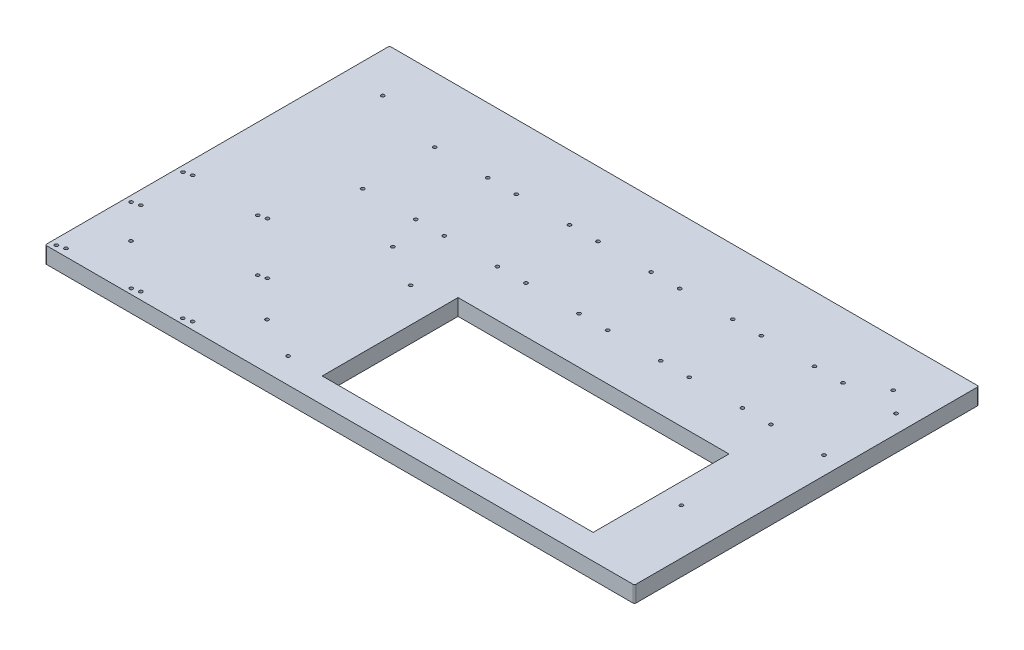
from build123d import *

# Parameters (mm, degrees)
SKETCH1_W           = 433
SKETCH1_H           = 253
BOSS_EXTRUDE1_DEPTH = 12
SKETCH2_R           = 1.25
CUT_EXTRUDE1_DEPTH  = 252.034858137
SKETCH3_R           = 1.25
CUT_EXTRUDE2_DEPTH  = 15
FILLET1_R           = 1
SKETCH4_W           = 199.073289142
SKETCH4_H           = 99.79518131
CUT_EXTRUDE3_DEPTH  = 15
SKETCH5_R           = 1.25
CUT_EXTRUDE4_DEPTH  = 252.034858137


with BuildPart() as part:
    # Sketch1 → Boss-Extrude1 (new body)
    with BuildSketch(Plane(origin=(0, 0, 0), x_dir=(1, 0, 0), z_dir=(0, 1, 0))):
        Rectangle(SKETCH1_W, SKETCH1_H)
    extrude(amount=BOSS_EXTRUDE1_DEPTH)

    # Sketch2 → Cut-Extrude1 (cut, through all)
    with BuildSketch(Plane(origin=(0, 12, 0), x_dir=(1, 0, 0), z_dir=(0, 1, 0))):
        with Locations(Location((-212.162759871, -122.618200896, 0), (0, 0, 270))):
            Circle(SKETCH2_R)
        with Locations(Location((-212.162759871, -29.618200896, 0), (0, 0, 270))):
            Circle(SKETCH2_R)
        with Locations(Location((-157.162759871, -29.618200896, 0), (0, 0, 270))):
            Circle(SKETCH2_R)
        with Locations(Location((-157.162759871, -122.618200896, 0), (0, 0, 270))):
            Circle(SKETCH2_R)
        with Locations(Location((104.420132929, 25.812618585, 0), (0, 0, 270))):
            Circle(SKETCH2_R)
        with Locations(Location((164.420132929, 25.812618585, 0), (0, 0, 270))):
            Circle(SKETCH2_R)
        with Locations(Location((143.420132929, 78.812618585, 0), (0, 0, 270))):
            Circle(SKETCH2_R)
        with Locations(Location((203.420132929, 78.812618585, 0), (0, 0, 270))):
            Circle(SKETCH2_R)
        with Locations(Location((104.420132929, 78.812618585, 0), (0, 0, 270))):
            Circle(SKETCH2_R)
        with Locations(Location((164.420132929, 78.812618585, 0), (0, 0, 270))):
            Circle(SKETCH2_R)
        with Locations(Location((143.420132929, 25.812618585, 0), (0, 0, 270))):
            Circle(SKETCH2_R)
        with Locations(Location((203.420132929, 25.812618585, 0), (0, 0, 270))):
            Circle(SKETCH2_R)
        with Locations(Location((-206.638150147, -121.099951967, 0), (0, 0, 270))):
            Circle(SKETCH2_R)
        with Locations(Location((-206.638150147, -28.099951967, 0), (0, 0, 270))):
            Circle(SKETCH2_R)
        with Locations(Location((-151.638150147, -28.099951967, 0), (0, 0, 270))):
            Circle(SKETCH2_R)
        with Locations(Location((-151.638150147, -121.099951967, 0), (0, 0, 270))):
            Circle(SKETCH2_R)
        with Locations(Location((-119.17119763, -122.685748213, 0), (0, 0, 270))):
            Circle(SKETCH2_R)
        with Locations(Location((-212.17119763, -67.685748213, 0), (0, 0, 270))):
            Circle(SKETCH2_R)
        with Locations(Location((-119.17119763, -67.685748213, 0), (0, 0, 270))):
            Circle(SKETCH2_R)
        with Locations(Location((-113.576162069, -121.096108824, 0), (0, 0, 270))):
            Circle(SKETCH2_R)
        with Locations(Location((44.420132929, 25.812618585, 0), (0, 0, 270))):
            Circle(SKETCH2_R)
        with Locations(Location((-206.576162069, -66.096108824, 0), (0, 0, 270))):
            Circle(SKETCH2_R)
        with Locations(Location((-113.576162069, -66.096108824, 0), (0, 0, 270))):
            Circle(SKETCH2_R)
        with Locations(Location((83.420132929, 78.812618585, 0), (0, 0, 270))):
            Circle(SKETCH2_R)
        with Locations(Location((44.420132929, 78.812618585, 0), (0, 0, 270))):
            Circle(SKETCH2_R)
        with Locations(Location((83.420132929, 25.812618585, 0), (0, 0, 270))):
            Circle(SKETCH2_R)
        with Locations(Location((-15.579867071, 25.812618585, 0), (0, 0, 270))):
            Circle(SKETCH2_R)
        with Locations(Location((23.420132929, 78.812618585, 0), (0, 0, 270))):
            Circle(SKETCH2_R)
        with Locations(Location((-15.579867071, 78.812618585, 0), (0, 0, 270))):
            Circle(SKETCH2_R)
        with Locations(Location((23.420132929, 25.812618585, 0), (0, 0, 270))):
            Circle(SKETCH2_R)
        with Locations(Location((-75.579867071, 25.812618585, 0), (0, 0, 270))):
            Circle(SKETCH2_R)
        with Locations(Location((-36.579867071, 78.812618585, 0), (0, 0, 270))):
            Circle(SKETCH2_R)
        with Locations(Location((-75.579867071, 78.812618585, 0), (0, 0, 270))):
            Circle(SKETCH2_R)
        with Locations(Location((-36.579867071, 25.812618585, 0), (0, 0, 270))):
            Circle(SKETCH2_R)
        with Locations(Location((-135.579867071, 25.812618585, 0), (0, 0, 270))):
            Circle(SKETCH2_R)
        with Locations(Location((-96.579867071, 78.812618585, 0), (0, 0, 270))):
            Circle(SKETCH2_R)
        with Locations(Location((-135.579867071, 78.812618585, 0), (0, 0, 270))):
            Circle(SKETCH2_R)
        with Locations(Location((-96.579867071, 25.812618585, 0), (0, 0, 270))):
            Circle(SKETCH2_R)
    extrude(amount=-CUT_EXTRUDE1_DEPTH, mode=Mode.SUBTRACT)

    # Sketch3 → Cut-Extrude2 (cut)
    with BuildSketch(Plane(origin=(0, 12, 0), x_dir=(1, 0, 0), z_dir=(0, 1, 0))):
        with Locations(Location((-56.5, -18, 0), (0, 0, 270))):
            Circle(SKETCH3_R)
        with Locations(Location((-56.5, -108, 0), (0, 0, 270))):
            Circle(SKETCH3_R)
        with Locations(Location((183, -58.5, 0), (0, 0, 270))):
            Circle(SKETCH3_R)
    extrude(amount=-CUT_EXTRUDE2_DEPTH, mode=Mode.SUBTRACT)

    # Fillet1
    fillet1_edges = [part.edges().sort_by_distance(p)[0] for p in [
        (-216.5, 6, -126.5),
        (216.5, 6, -126.5),
        (216.5, 6, 126.5),
        (-216.5, 6, 126.5),
    ]]
    fillet(fillet1_edges, radius=FILLET1_R)

    # Sketch4 → Cut-Extrude3 (cut)
    with BuildSketch(Plane(origin=(0, 12, 0), x_dir=(1, 0, 0), z_dir=(0, 1, 0))):
        with Locations((68.251302033, -58.249629494)):
            Rectangle(SKETCH4_W, SKETCH4_H)
    extrude(amount=-CUT_EXTRUDE3_DEPTH, mode=Mode.SUBTRACT)

    # Sketch5 → Cut-Extrude4 (cut, through all)
    with BuildSketch(Plane.XZ):
        with Locations(Location((-87.5, 0, 0), (0, 0, 270))):
            Circle(SKETCH5_R)
        with Locations(Location((187.5, -92.5, 0), (0, 0, 270))):
            Circle(SKETCH5_R)
        with Locations(Location((-87.5, 92.5, 0), (0, 0, 270))):
            Circle(SKETCH5_R)
        with Locations(Location((-187.5, 92.5, 0), (0, 0, 270))):
            Circle(SKETCH5_R)
        with Locations(Location((-187.5, -92.5, 0), (0, 0, 270))):
            Circle(SKETCH5_R)
    extrude(amount=-CUT_EXTRUDE4_DEPTH, mode=Mode.SUBTRACT)


solid = part.part
